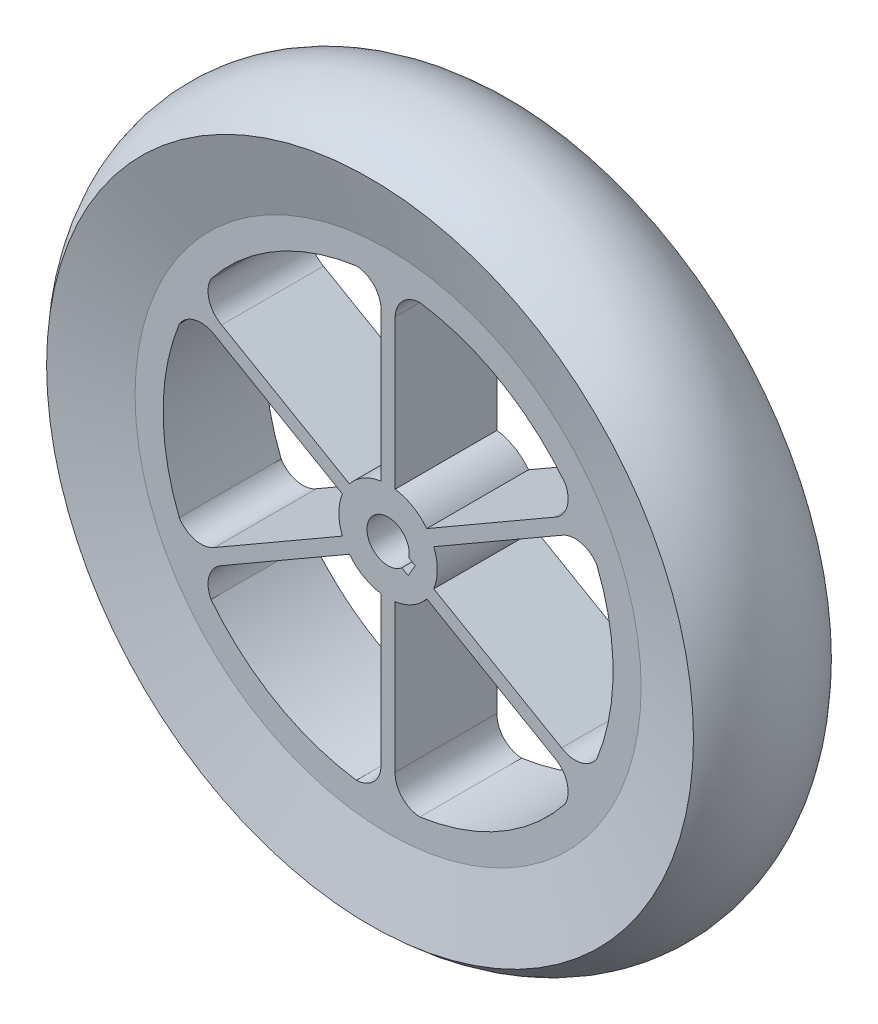
from build123d import *
from build123d.topology import SkipClean

# Parameters (mm, degrees)
SKETCH1_R           = 158.75
BOSS_EXTRUDE1_DEPTH = 45.974


with BuildPart() as part:
    # Sketch1 → Boss-Extrude1 (new body)
    with BuildSketch(Plane.XY):
        Circle(SKETCH1_R)
        with BuildLine():
            Line((-3.175, 88.6419075), (-3.175, 21.997045256))
            ThreePointArc((-3.175, 21.997045256), (-11.1125, 19.247414599), (-17.4625, 13.748153285))
            Line((-17.4625, 13.748153285), (-75.178643735, 47.070584407))
            ThreePointArc((-75.178643735, 47.070584407), (-80.796594988, 53.906629613), (-79.935272493, 62.712934961))
            ThreePointArc((-79.935272493, 62.712934961), (-50.8, 87.988181024), (-14.343358575, 100.582444118))
            ThreePointArc((-14.343358575, 100.582444118), (-6.286213183, 96.925218605), (-3.175, 88.6419075))
        make_face(mode=Mode.SUBTRACT)
        with BuildLine():
            ThreePointArc((14.343358575, 100.582444118), (50.8, 87.988181024), (79.935272493, 62.712934961))
            ThreePointArc((79.935272493, 62.712934961), (80.796594988, 53.906629613), (75.178643735, 47.070584407))
            Line((75.178643735, 47.070584407), (17.4625, 13.748153285))
            ThreePointArc((17.4625, 13.748153285), (11.1125, 19.247414599), (3.175, 21.997045256))
            Line((3.175, 21.997045256), (3.175, 88.6419075))
            ThreePointArc((3.175, 88.6419075), (6.286213183, 96.925218605), (14.343358575, 100.582444118))
        make_face(mode=Mode.SUBTRACT)
        with BuildLine():
            ThreePointArc((-94.278631069, -37.869509157), (-101.6, 0), (-94.278631069, 37.869509157))
            ThreePointArc((-94.278631069, 37.869509157), (-87.082808171, 43.018588992), (-78.353643735, 41.571323093))
            Line((-78.353643735, 41.571323093), (-20.6375, 8.248891971))
            ThreePointArc((-20.6375, 8.248891971), (-22.225, 0), (-20.6375, -8.248891971))
            Line((-20.6375, -8.248891971), (-78.353643735, -41.571323093))
            ThreePointArc((-78.353643735, -41.571323093), (-87.082808171, -43.018588992), (-94.278631069, -37.869509157))
        make_face(mode=Mode.SUBTRACT)
        with BuildLine():
            ThreePointArc((-14.343358575, -100.582444118), (-50.8, -87.988181024), (-79.935272493, -62.712934961))
            ThreePointArc((-79.935272493, -62.712934961), (-80.796594988, -53.906629613), (-75.178643735, -47.070584407))
            Line((-75.178643735, -47.070584407), (-17.4625, -13.748153285))
            ThreePointArc((-17.4625, -13.748153285), (-11.1125, -19.247414599), (-3.175, -21.997045256))
            Line((-3.175, -21.997045256), (-3.175, -88.6419075))
            ThreePointArc((-3.175, -88.6419075), (-6.286213183, -96.925218605), (-14.343358575, -100.582444118))
        make_face(mode=Mode.SUBTRACT)
        with BuildLine():
            ThreePointArc((79.935272493, -62.712934961), (50.8, -87.988181024), (14.343358575, -100.582444118))
            ThreePointArc((14.343358575, -100.582444118), (6.286213183, -96.925218605), (3.175, -88.6419075))
            Line((3.175, -88.6419075), (3.175, -21.997045256))
            ThreePointArc((3.175, -21.997045256), (11.1125, -19.247414599), (17.4625, -13.748153285))
            Line((17.4625, -13.748153285), (75.178643735, -47.070584407))
            ThreePointArc((75.178643735, -47.070584407), (80.796594988, -53.906629613), (79.935272493, -62.712934961))
        make_face(mode=Mode.SUBTRACT)
        with BuildLine():
            ThreePointArc((94.278631069, -37.869509157), (87.082808171, -43.018588992), (78.353643735, -41.571323093))
            Line((78.353643735, -41.571323093), (20.6375, -8.248891971))
            ThreePointArc((20.6375, -8.248891971), (22.225, 0), (20.6375, 8.248891971))
            Line((20.6375, 8.248891971), (78.353643735, 41.571323093))
            ThreePointArc((78.353643735, 41.571323093), (87.082808171, 43.018588992), (94.278631069, 37.869509157))
            ThreePointArc((94.278631069, 37.869509157), (101.6, 0), (94.278631069, -37.869509157))
        make_face(mode=Mode.SUBTRACT)
        with BuildLine():
            Line((9.059069904, -8.896430657), (6.189629933, -7.239758718))
            ThreePointArc((6.189629933, -7.239758718), (-8.248891971, 4.7625), (9.364629933, -1.740497404))
            Line((9.364629933, -1.740497404), (12.234069904, -3.397169343))
            Line((12.234069904, -3.397169343), (9.059069904, -8.896430657))
        make_face(mode=Mode.SUBTRACT)
    extrude(amount=BOSS_EXTRUDE1_DEPTH)

    # Sketch2 → Cut-Revolve1 (revolve, cut)
    with BuildSketch(Plane(origin=(0, 0, 0), x_dir=(1, 0, 0), z_dir=(0, 1, 0))):
        with BuildLine():
            Line((158.75, -45.974), (158.75, -22.987))
            ThreePointArc((158.75, -22.987), (157.121901144, -34.91676007), (152.356680652, -45.974))
            Line((152.356680652, -45.974), (158.75, -45.974))
        make_face()
        with BuildLine():
            Line((158.75, 0), (152.356680652, 0))
            ThreePointArc((152.356680652, 0), (157.121901144, -11.05723993), (158.75, -22.987))
            Line((158.75, -22.987), (158.75, 0))
        make_face()
    revolve(axis=Axis((0, 0, 0), (0, 0, -1)), mode=Mode.SUBTRACT)

    # Sketch2<6> → Revolve2 (revolve)
    with SkipClean():  # the faces are left unmerged after this step: merging them gives an invalid solid
        with BuildSketch(Plane(origin=(0, 0, 0), x_dir=(1, 0, 0), z_dir=(0, 1, 0))):
            with BuildLine():
                ThreePointArc((152.356680652, 0), (149.439969417, 4.258386632), (146.05, 8.150579906))
                Line((146.05, 8.150579906), (114.256680652, 0))
                Line((114.256680652, 0), (152.356680652, 0))
            make_face()
            with BuildLine():
                ThreePointArc((146.05, -54.124579906), (149.439969417, -50.232386632), (152.356680652, -45.974))
                Line((152.356680652, -45.974), (114.256680652, -45.974))
                Line((114.256680652, -45.974), (146.05, -54.124579906))
            make_face()
        revolve(axis=Axis((0, 0, 0), (0, 0, -1)))


solid = part.part
